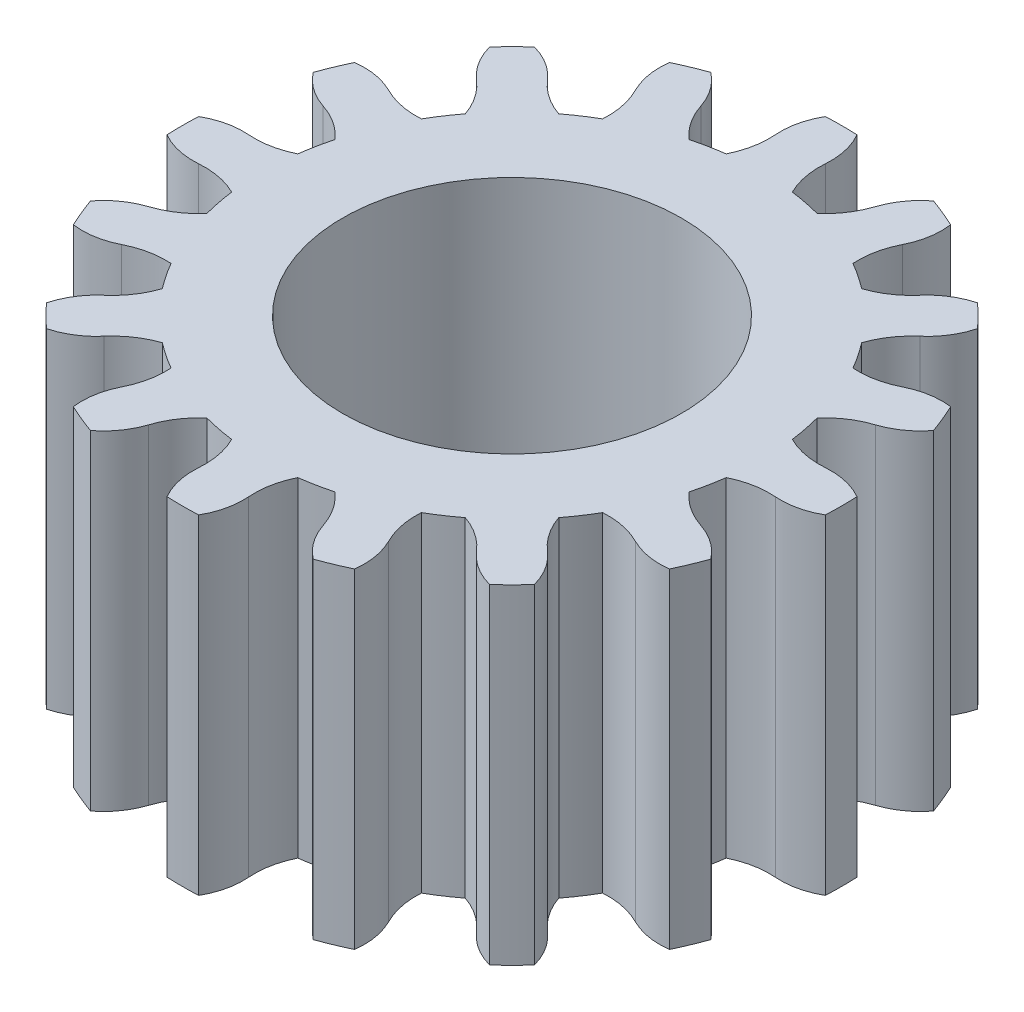
from build123d import *

# Parameters (mm, degrees)
SKETCH1_R           = 3.175
SKETCH1_R_2         = 1.63195
BOSS_EXTRUDE1_DEPTH = 3.175
CUT_EXTRUDE1_DEPTH  = 6.499261314
CIRPATTERN1_COUNT   = 16


with BuildPart() as part:
    # Sketch1 → Boss-Extrude1 (new body)
    with BuildSketch(Plane(origin=(0, 0, 0), x_dir=(1, 0, 0), z_dir=(0, 1, 0))):
        with Locations(Location((0, 0, 0), (0, 0, 270))):
            Circle(SKETCH1_R)
        with Locations(Location((0, 0, 0), (0, 0, 270))):
            Circle(SKETCH1_R_2, mode=Mode.SUBTRACT)
    extrude(amount=BOSS_EXTRUDE1_DEPTH)

    # Sketch2 → Cut-Extrude1 (cut, through all)
    with BuildSketch(Plane(origin=(0, 3.175, 0), x_dir=(1, 0, 0), z_dir=(0, 1, 0))):
        with BuildLine():
            ThreePointArc((-0.1524, 3.171340291), (-0.226750807, 2.98179915), (-0.241694661, 2.778746034))
            ThreePointArc((-0.241694661, 2.778746034), (-0.25338078, 2.575323775), (-0.318555556, 2.382270856))
            ThreePointArc((-0.318555556, 2.382270856), (-0.468894712, 2.357292902), (-0.61734863, 2.322837219))
            ThreePointArc((-0.61734863, 2.322837219), (-0.751440425, 2.476253552), (-0.84008332, 2.659719129))
            ThreePointArc((-0.84008332, 2.659719129), (-0.931594704, 2.841596982), (-1.072820147, 2.98825734))
            ThreePointArc((-1.072820147, 2.98825734), (-0.619411772, 3.113993265), (-0.1524, 3.171340291))
        make_face()
    cut_extrude1 = extrude(amount=-CUT_EXTRUDE1_DEPTH, mode=Mode.SUBTRACT)

    # CirPattern1: Cut-Extrude1 ×16 about axis
    cirpattern1_axis = Axis((0, 0, 0), (0, 1, 0))
    for i in range(1, CIRPATTERN1_COUNT):
        add(cut_extrude1.rotate(cirpattern1_axis, i * 360 / CIRPATTERN1_COUNT), mode=Mode.SUBTRACT)


solid = part.part
